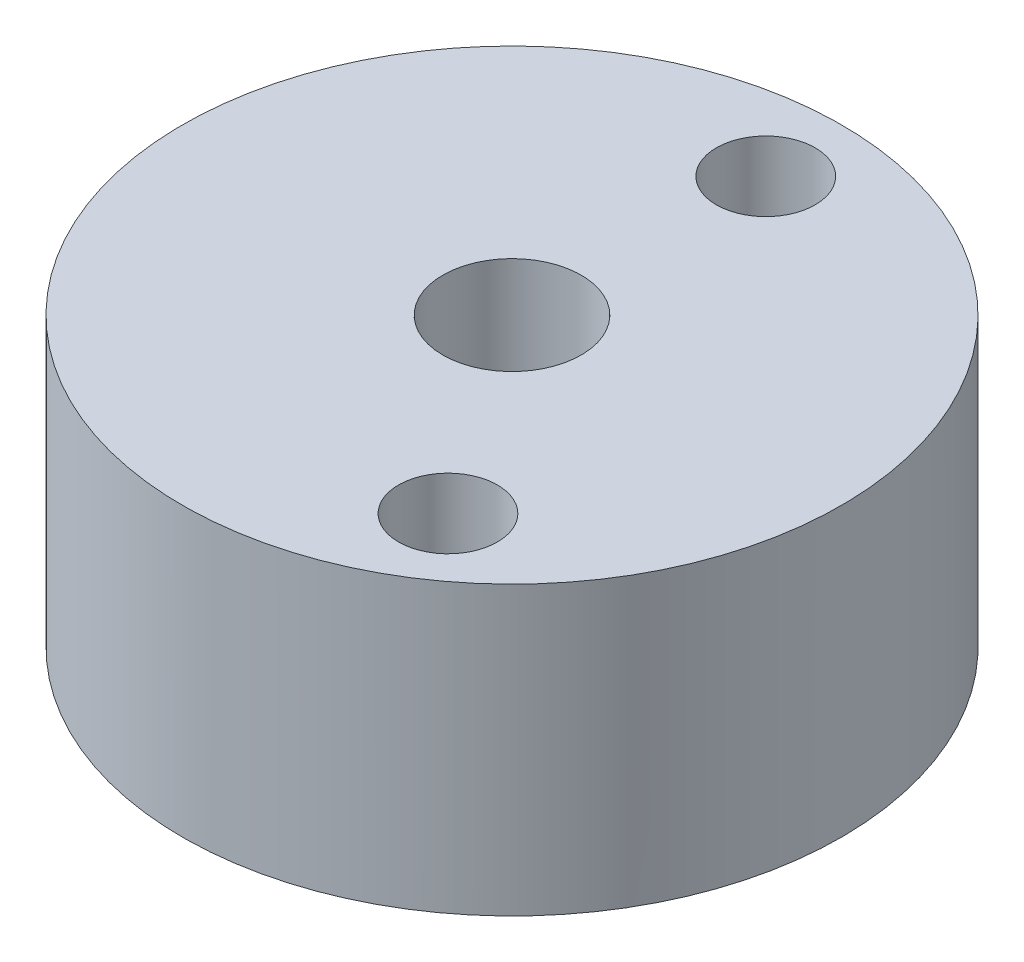
from build123d import *

# Parameters (mm, degrees)
BOSS_EXTRUDE1_DEPTH      = 8.5
BOSS_EXTRUDE1_DEPTH_BACK = 2
SKETCH1_R                = 10
SKETCH3_W                = 3.5
SKETCH3_H                = 2.6
SKETCH4_R                = 2.1
CUT_EXTRUDE1_DEPTH       = 17.615368622
SKETCH5_R                = 1.5
CUT_EXTRUDE2_DEPTH       = 17.615368622


with BuildPart() as part:
    # Sketch1 → Boss-Extrude1 (new, two sides: drawn at the far end of the back side and taken through both)
    with BuildSketch(Plane(origin=(0, 0, 0), x_dir=(1, 0, 0), z_dir=(0, 1, 0)).offset(-BOSS_EXTRUDE1_DEPTH_BACK)):
        with Locations(Location((0, 0, 0), (0, 0, 270))):
            Circle(SKETCH1_R)
    extrude(amount=BOSS_EXTRUDE1_DEPTH + BOSS_EXTRUDE1_DEPTH_BACK)

    # Sketch2 → Cut-Revolve1 (revolve, cut)
    with BuildSketch(Plane(origin=(0, 0, 0), x_dir=(0, 0, -1), z_dir=(1, 0, 0))):
        with BuildLine():
            Line((0, 0), (0, -451))
            ThreePointArc((0, -451), (-225.5, -225.5), (0, 0))
        make_face()
    revolve(axis=Axis((0, 0, 0), (0, -1, 0)), mode=Mode.SUBTRACT)

    # Sketch3 → Cut-Revolve2 (revolve, cut)
    with BuildSketch(Plane(origin=(0, 0, 0), x_dir=(0, 0, -1), z_dir=(1, 0, 0)), mode=Mode.PRIVATE) as cut_revolve2_sk:
        with Locations((-1.75, 1.078161392)):
            Rectangle(SKETCH3_W, SKETCH3_H)
    revolve(cut_revolve2_sk.sketch.rotate(Axis((0, 2.378161392, 0), (0, -1, 0)), 84.935699762), axis=Axis((0, 2.378161392, 0), (0, -1, 0)), mode=Mode.SUBTRACT)

    # Sketch4 → Cut-Extrude1 (cut, through all)
    with BuildSketch(Plane(origin=(0, 8.5, 0), x_dir=(1, 0, 0), z_dir=(0, 1, 0))):
        with Locations(Location((0, 0, 0), (0, 0, 270))):
            Circle(SKETCH4_R)
    extrude(amount=-CUT_EXTRUDE1_DEPTH, mode=Mode.SUBTRACT)

    # Sketch5 → Cut-Extrude2 (cut, through all)
    with BuildSketch(Plane(origin=(0, 8.5, 0), x_dir=(1, 0, 0), z_dir=(0, 1, 0))):
        with Locations(Location((0.20360383, 7.497235856, 0), (0, 0, 270))):
            Circle(SKETCH5_R)
        with Locations(Location((4.24204571, -6.185066547, 0), (0, 0, 270))):
            Circle(SKETCH5_R)
    extrude(amount=-CUT_EXTRUDE2_DEPTH, mode=Mode.SUBTRACT)


solid = part.part
